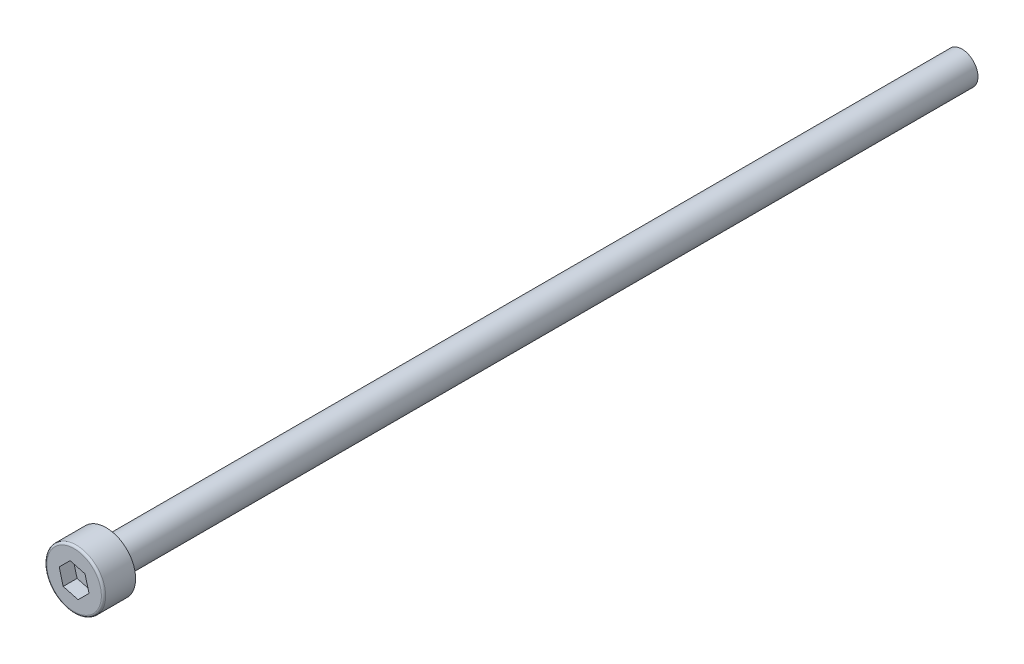
from build123d import *

# Parameters (mm, degrees)
SKETCH_1_R          = 2.75
EXTRUDE_1_DEPTH     = 3
CUT_EXTRUDE_1_DEPTH = 1.3
SKETCH_3_R          = 1.5
EXTRUDE_2_DEPTH     = 80
FILLET_1_R          = 0.2


with BuildPart() as part:
    # 草图1 → 凸台-拉伸1 (new body)
    with BuildSketch(Plane.XY):
        Circle(SKETCH_1_R)
    extrude(amount=EXTRUDE_1_DEPTH)

    # 草图2 → 切除-拉伸1 (cut)
    with BuildSketch(Plane.XY.offset(3)):
        Polygon((-1.020620726, -1.020620726), (0.373573113, -1.39419384), (1.39419384, -0.373573113), (1.020620726, 1.020620726), (-0.373573113, 1.39419384), (-1.39419384, 0.373573113), align=None)
    extrude(amount=-CUT_EXTRUDE_1_DEPTH, mode=Mode.SUBTRACT)

    # 草图3 → 凸台-拉伸2 (add)
    with BuildSketch(Plane(origin=(0, 0, 0), x_dir=(-1, 0, 0), z_dir=(0, 0, -1))):
        with Locations(Location((0, 0, 0), (0, 0, 180))):
            Circle(SKETCH_3_R)
    extrude(amount=EXTRUDE_2_DEPTH)

    # 圆角1
    fillet_1_edges = [part.edges().sort_by_distance(p)[0] for p in [
        (-2.75, 0, 3),
    ]]
    fillet(fillet_1_edges, radius=FILLET_1_R)


solid = part.part
